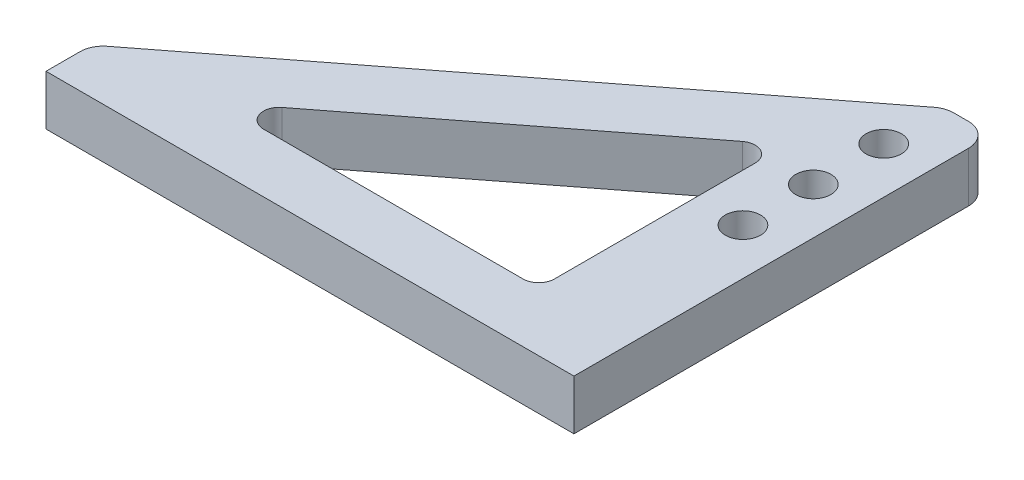
from build123d import *

# Parameters (mm, degrees)
SKETCH1_R           = 0.5715
BOSS_EXTRUDE1_DEPTH = 1.6256
FILLET1_R           = 0.508
FILLET2_R           = 0.762


with BuildPart() as part:
    # Sketch1 → Boss-Extrude1 (new body)
    with BuildSketch(Plane(origin=(0, 0, 0), x_dir=(1, 0, 0), z_dir=(0, 1, 0))):
        Polygon((1.905, 1.4732), (17.54785055, 13.570337759), (19.05, 13.570337759), (19.05, 0), (1.905, 0), align=None)
        with Locations(Location((17.54785055, 11.562216741, 0), (0, 0, 270))):
            Circle(SKETCH1_R, mode=Mode.SUBTRACT)
        with Locations(Location((17.54785055, 9.276216741, 0), (0, 0, 270))):
            Circle(SKETCH1_R, mode=Mode.SUBTRACT)
        with Locations(Location((17.54785055, 6.990216741, 0), (0, 0, 270))):
            Circle(SKETCH1_R, mode=Mode.SUBTRACT)
        Polygon((5.577391241, 1.905), (16.002, 1.905), (16.002, 9.96669744), align=None, mode=Mode.SUBTRACT)
    extrude(amount=BOSS_EXTRUDE1_DEPTH)

    # Fillet1
    fillet1_edges = [part.edges().sort_by_distance(p)[0] for p in [
        (16.002, 0.8128, -9.96669744),
        (5.577391241, 0.8128, -1.905),
        (16.002, 0.8128, -1.905),
    ]]
    fillet(fillet1_edges, radius=FILLET1_R)

    # Fillet2
    fillet2_edges = [part.edges().sort_by_distance(p)[0] for p in [
        (1.905, 0.8128, -1.4732),
        (17.54785055, 0.8128, -13.570337759),
        (19.05, 0.8128, -13.570337759),
    ]]
    fillet(fillet2_edges, radius=FILLET2_R)


solid = part.part
